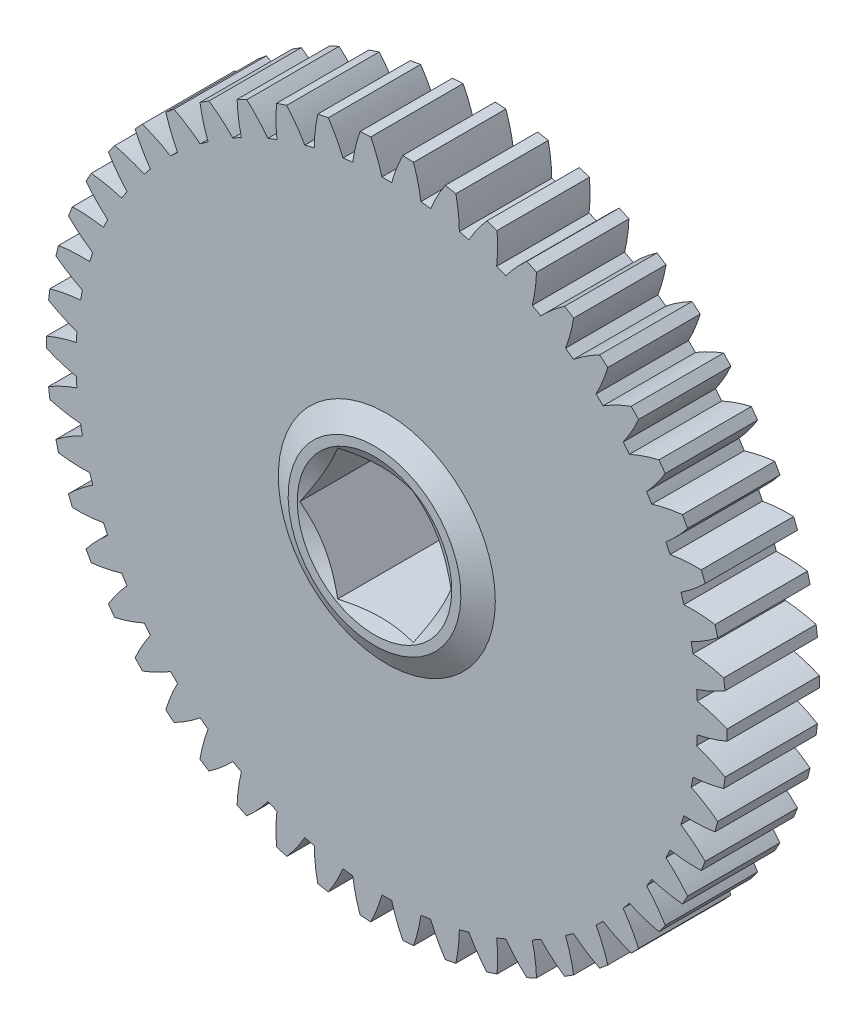
from build123d import *

# Parameters (mm, degrees)
SKETCH1_R           = 30.1625
EXTRUDE1_DEPTH      = 4.4831
EXTRUDE2_START      = -8.9662
EXTRUDE2_DEPTH      = 8.9662
CIRPATTERN1_COUNT   = 50
EXTRUDE3_DEPTH      = 48.018260807
EXTRUDE3_DEPTH_BACK = 48.018260807


with BuildPart() as part:
    # Sketch1 → Extrude1 (new, symmetric)
    with BuildSketch(Plane.XY):
        Circle(SKETCH1_R)
    extrude(amount=EXTRUDE1_DEPTH, both=True)

    # Sketch2 → Extrude2 (add)
    with BuildSketch(Plane(origin=(0, 0, -4.4831), x_dir=(-1, 0, 0), z_dir=(0, 0, -1)).offset(EXTRUDE2_START)):
        with BuildLine():
            Line((33.02, 0.51867689), (33.02, -0.51867689))
            ThreePointArc((33.02, -0.51867689), (31.596988062, -1.041800729), (30.129015746, -1.4208506))
            ThreePointArc((30.129015746, -1.4208506), (30.1625, 0), (30.129015746, 1.4208506))
            ThreePointArc((30.129015746, 1.4208506), (31.596988062, 1.041800729), (33.02, 0.51867689))
        make_face()
    extrude2 = extrude(amount=EXTRUDE2_DEPTH)

    # CirPattern1: Extrude2 ×50 about axis
    cirpattern1_axis = Axis((0, 0, 0), (0, 0, 1))
    for i in range(1, CIRPATTERN1_COUNT):
        add(extrude2.rotate(cirpattern1_axis, i * 360 / CIRPATTERN1_COUNT))

    # Sketch3 → Revolve1 (revolve)
    with BuildSketch(Plane.YZ):
        Polygon((10.5304082, 4.4831), (8.381903034, 5.6769), (7.493136714, 5.6769), (5.344631549, 4.4831), align=None)
    revolve(axis=Axis((0, 0, 8.90651), (0, 0, 1)))

    # Sketch4 → Extrude3 (cut, two sides: drawn at the far end of the back side and taken through both)
    with BuildSketch(Plane.XY.offset(-EXTRUDE3_DEPTH_BACK)):
        Polygon((-3.666174209, -6.35), (3.666174209, -6.35), (7.332348419, 0), (3.666174209, 6.35), (-3.666174209, 6.35), (-7.332348419, 0), align=None)
    extrude(amount=EXTRUDE3_DEPTH + EXTRUDE3_DEPTH_BACK, mode=Mode.SUBTRACT)


solid = part.part
